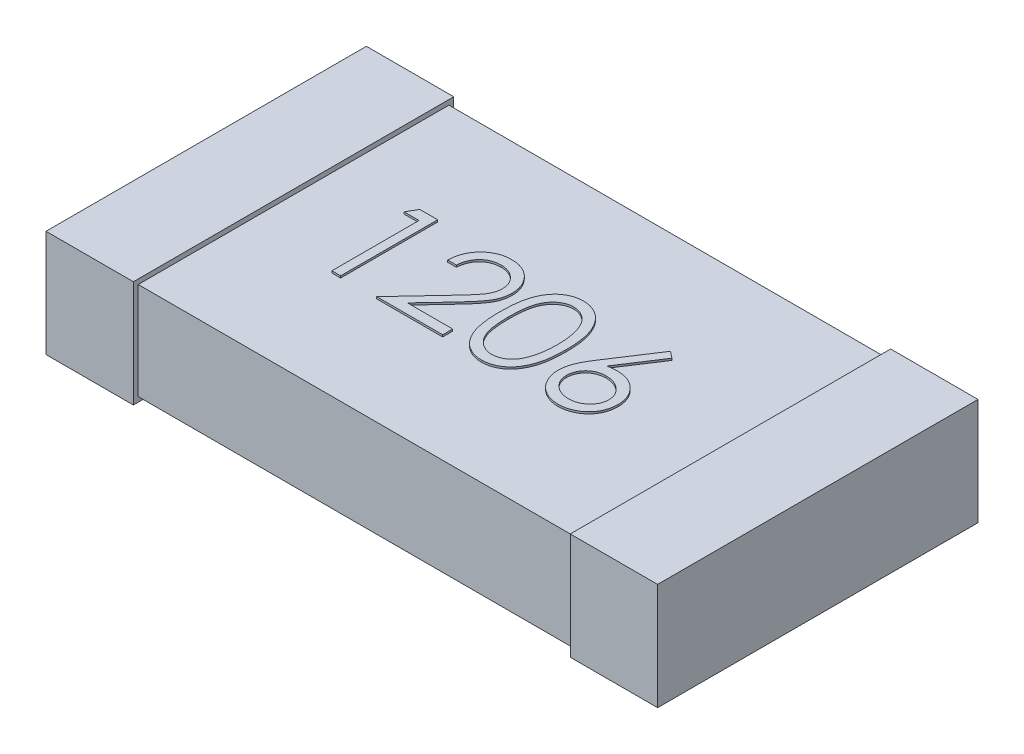
from build123d import *

# Parameters (mm, degrees)
SKETCH1_W            = 3.1
SKETCH1_H            = 1.6
BOSS_EXTRUDE1_DEPTH  = 0.5
BOSS_EXTRUDE5_DEPTH  = 1.6
SKETCH5_W            = 0.45
SKETCH5_H            = 0.55
BOSS_EXTRUDE6_DEPTH  = 0.025
SKETCH6_W            = 0.45
SKETCH6_H            = 0.55
BOSS_EXTRUDE7_DEPTH  = 0.025
BOSS_EXTRUDE8_DEPTH  = 1.6
SKETCH8_W            = 0.45
SKETCH8_H            = 0.55
BOSS_EXTRUDE9_DEPTH  = 0.025
SKETCH9_W            = 0.45
SKETCH9_H            = 0.55
BOSS_EXTRUDE10_DEPTH = 0.025
BOSS_EXTRUDE11_DEPTH = 0.01


with BuildPart() as part:
    # Sketch1 → Boss-Extrude1 (new body)
    with BuildSketch(Plane(origin=(0, 0, 0), x_dir=(1, 0, 0), z_dir=(0, 1, 0))):
        Rectangle(SKETCH1_W, SKETCH1_H)
    extrude(amount=BOSS_EXTRUDE1_DEPTH)

    # Sketch4 → Boss-Extrude5 (add)
    with BuildSketch(Plane.XY.offset(0.8)):
        Polygon((-1.125, 0.5), (-1.55, 0.5), (-1.55, 0), (-1.125, 0), (-1.125, -0.025), (-1.575, -0.025), (-1.575, 0.525), (-1.125, 0.525), align=None)
    extrude(amount=-BOSS_EXTRUDE5_DEPTH)

    # Sketch5 → Boss-Extrude6 (add)
    with BuildSketch(Plane.XY.offset(0.8)):
        with Locations((-1.35, 0.25)):
            Rectangle(SKETCH5_W, SKETCH5_H)
    extrude(amount=BOSS_EXTRUDE6_DEPTH)

    # Sketch6 → Boss-Extrude7 (add)
    with BuildSketch(Plane(origin=(0, 0, -0.8), x_dir=(-1, 0, 0), z_dir=(0, 0, -1))):
        with Locations((1.35, 0.25)):
            Rectangle(SKETCH6_W, SKETCH6_H)
    extrude(amount=BOSS_EXTRUDE7_DEPTH)

    # Sketch7 → Boss-Extrude8 (add)
    with BuildSketch(Plane.XY.offset(0.8)):
        Polygon((1.125, 0.5), (1.55, 0.5), (1.55, 0), (1.125, 0), (1.125, -0.025), (1.575, -0.025), (1.575, 0.525), (1.125, 0.525), align=None)
    extrude(amount=-BOSS_EXTRUDE8_DEPTH)

    # Sketch8 → Boss-Extrude9 (add)
    with BuildSketch(Plane.XY.offset(0.8)):
        with Locations((1.35, 0.25)):
            Rectangle(SKETCH8_W, SKETCH8_H)
    extrude(amount=BOSS_EXTRUDE9_DEPTH)

    # Sketch9 → Boss-Extrude10 (add)
    with BuildSketch(Plane(origin=(0, 0, -0.8), x_dir=(-1, 0, 0), z_dir=(0, 0, -1))):
        with Locations((-1.35, 0.25)):
            Rectangle(SKETCH9_W, SKETCH9_H)
    extrude(amount=BOSS_EXTRUDE10_DEPTH)

    # Sketch10 → Boss-Extrude11 (add)
    # profile 1 of 4: a face of its own
    with BuildSketch(Plane(origin=(0, 0.5, 0), x_dir=(1, 0, 0), z_dir=(0, 1, 0))):
        Polygon((-0.72510345, 0.25), (-0.632655533, 0.25), (-0.632655533, -0.25), (-0.677527328, -0.25), (-0.677527328, 0.198717949), (-0.754450405, 0.198717949), align=None)
    # profile 2 of 4: a face of its own
    with BuildSketch(Plane(origin=(0, 0.5, 0), x_dir=(1, 0, 0), z_dir=(0, 1, 0))):
        with BuildLine():
            Line((-0.382655533, 0.096153846), (-0.427527328, 0.096153846))
            add(Edge.make_bspline(
                [(-0.427527328, 0.096153846), (-0.427234878, 0.10210683), (-0.426660513, 0.113798332), (-0.423970757, 0.130844605), (-0.420122061, 0.147138147), (-0.414680424, 0.162548135), (-0.407922385, 0.177210822), (-0.399818095, 0.191067967), (-0.390218974, 0.204066708), (-0.379332297, 0.216086543), (-0.367508206, 0.227113339), (-0.354750215, 0.236635516), (-0.341343782, 0.244680898), (-0.327329582, 0.251406789), (-0.312549502, 0.256455339), (-0.297137665, 0.260201287), (-0.28102636, 0.262455051), (-0.270049214, 0.262697306), (-0.264466431, 0.262820513)],
                knots=[0, 0, 0, 0, 1.10065271, 2.161652631, 3.183658789, 4.190468796, 5.17591951, 6.163126047, 7.15150782, 8.156236427, 9.156009102, 10.134482811, 11.092018607, 12.041330605, 13.001268258, 13.972401359, 14.968799086, 16, 16, 16, 16], degree=3))
            add(Edge.make_bspline(
                [(-0.264466431, 0.262820513), (-0.258983849, 0.262692162), (-0.248210771, 0.262439957), (-0.232487626, 0.260274096), (-0.217519441, 0.256881868), (-0.203335475, 0.252122523), (-0.190048894, 0.245724748), (-0.177559888, 0.238039385), (-0.165719772, 0.229150838), (-0.15506166, 0.218686007), (-0.145274791, 0.207514238), (-0.136831612, 0.195587395), (-0.12960116, 0.183268925), (-0.123574349, 0.170464896), (-0.119137757, 0.15705475), (-0.115769442, 0.143233721), (-0.113865526, 0.128858748), (-0.113573322, 0.11912924), (-0.113424764, 0.114182692)],
                knots=[0, 0, 0, 0, 1.111607364, 2.184268762, 3.212621178, 4.221274766, 5.211760367, 6.196651075, 7.1921475, 8.207485113, 9.220403448, 10.201281604, 11.166441695, 12.114753415, 13.065576456, 14.026450734, 14.996634279, 16, 16, 16, 16], degree=3))
            add(Edge.make_bspline(
                [(-0.113424764, 0.114182692), (-0.113666659, 0.107218716), (-0.114146203, 0.093412971), (-0.118248257, 0.073125134), (-0.124654902, 0.053468931), (-0.13236881, 0.037649316), (-0.140150588, 0.024901674), (-0.147163089, 0.014406145), (-0.155372347, 0.003105364), (-0.164897847, -0.008962827), (-0.175542543, -0.021892957), (-0.187402852, -0.035677213), (-0.20056335, -0.05017318), (-0.209800278, -0.06007398), (-0.214586623, -0.065204327)],
                knots=[0, 0, 0, 0, 1.184426356, 2.348067706, 3.509069118, 4.696110526, 5.333549288, 6.050745305, 6.844228056, 7.710549037, 8.667450064, 9.695053472, 10.805634456, 12, 12, 12, 12], degree=3))
            Line((-0.214586623, -0.065204327), (-0.339686783, -0.198717949))
            Line((-0.339686783, -0.198717949), (-0.107014508, -0.198717949))
            Line((-0.107014508, -0.198717949), (-0.107014508, -0.25))
            Line((-0.107014508, -0.25), (-0.446758098, -0.25))
            Line((-0.446758098, -0.25), (-0.252847841, -0.04306891))
            add(Edge.make_bspline(
                [(-0.252847841, -0.04306891), (-0.248126715, -0.038140581), (-0.239058396, -0.028674268), (-0.226232314, -0.014853846), (-0.214712458, -0.002032483), (-0.20442426, 0.009765596), (-0.195590902, 0.020712963), (-0.187752011, 0.030455063), (-0.181471213, 0.039419985), (-0.174654728, 0.049811501), (-0.16805273, 0.062498975), (-0.162379536, 0.078003788), (-0.158920272, 0.093964824), (-0.158505296, 0.104750829), (-0.158296559, 0.110176282)],
                knots=[0, 0, 0, 0, 1.329631726, 2.553950428, 3.673215718, 4.687767853, 5.603093632, 6.413772471, 7.123043292, 7.734684054, 8.834405432, 9.900288307, 10.943827018, 12, 12, 12, 12], degree=3))
            add(Edge.make_bspline(
                [(-0.158296559, 0.110176282), (-0.158387379, 0.11358791), (-0.158566369, 0.120311575), (-0.16014604, 0.13016954), (-0.162533255, 0.139678799), (-0.165954006, 0.148868602), (-0.170469255, 0.157646552), (-0.175965452, 0.166023335), (-0.18230689, 0.174121759), (-0.189642785, 0.181715087), (-0.197701574, 0.188669545), (-0.206215038, 0.194830129), (-0.215222196, 0.199978573), (-0.22468507, 0.204199073), (-0.23457728, 0.207509842), (-0.244917958, 0.209803924), (-0.255678532, 0.211244279), (-0.263026174, 0.211439161), (-0.266770117, 0.211538462)],
                knots=[0, 0, 0, 0, 0.991446411, 1.95395049, 2.89581595, 3.838931463, 4.798493298, 5.75982156, 6.748411868, 7.785213223, 8.824556874, 9.840280684, 10.836137867, 11.835679398, 12.848801643, 13.863922112, 14.911575587, 16, 16, 16, 16], degree=3))
            add(Edge.make_bspline(
                [(-0.266770117, 0.211538462), (-0.270680236, 0.211436314), (-0.278359064, 0.211235713), (-0.289633211, 0.209832476), (-0.300388322, 0.207411641), (-0.310651451, 0.204100688), (-0.320439964, 0.199892324), (-0.329706256, 0.194650646), (-0.338429526, 0.188395861), (-0.346626172, 0.181304353), (-0.354178169, 0.173408981), (-0.360813437, 0.164607558), (-0.366611153, 0.155060785), (-0.371669615, 0.14479442), (-0.375777571, 0.133715309), (-0.378916592, 0.121862779), (-0.381400427, 0.109288296), (-0.382230216, 0.100604713), (-0.382655533, 0.096153846)],
                knots=[0, 0, 0, 0, 1.031018746, 2.02475058, 2.990194455, 3.934040569, 4.864654155, 5.795059489, 6.735614925, 7.690564532, 8.649604399, 9.611025574, 10.590972636, 11.591080095, 12.624614302, 13.701020113, 14.821632451, 16, 16, 16, 16], degree=3))
        make_face()
    # profile 3 of 4: a face of its own
    with BuildSketch(Plane(origin=(0, 0.5, 0), x_dir=(1, 0, 0), z_dir=(0, 1, 0))):
        with BuildLine():
            add(Edge.make_bspline(
                [(-0.062142713, -0.000200321), (-0.062095853, 0.007813592), (-0.062004828, 0.023380733), (-0.060992196, 0.046064253), (-0.059310004, 0.067344294), (-0.057004665, 0.087221875), (-0.054199239, 0.105702127), (-0.05045417, 0.122735664), (-0.046195198, 0.138401322), (-0.041259134, 0.152750186), (-0.03568945, 0.165975572), (-0.029627413, 0.17832203), (-0.022832442, 0.189770877), (-0.015692883, 0.200504847), (-0.00791973, 0.210348232), (0.000265811, 0.219440041), (0.009183222, 0.227570148), (0.018529366, 0.234976763), (0.028388861, 0.241469544), (0.03848067, 0.247188507), (0.048874257, 0.252074202), (0.059597997, 0.255915693), (0.070555506, 0.259088671), (0.081785087, 0.261258521), (0.093305281, 0.262623794), (0.101081201, 0.262754318), (0.105024755, 0.262820513)],
                knots=[0, 0, 0, 0, 1.646270934, 3.197905019, 4.663502075, 6.030701355, 7.308322542, 8.50163776, 9.611534131, 10.641858119, 11.616356847, 12.558055219, 13.465016945, 14.349605745, 15.204443733, 16.039544428, 16.859896111, 17.680448484, 18.487036065, 19.28249412, 20.06191084, 20.843045899, 21.620316918, 22.403196591, 23.190181807, 24, 24, 24, 24], degree=3))
            add(Edge.make_bspline(
                [(0.105024755, 0.262820513), (0.109001252, 0.262750825), (0.116909253, 0.262612238), (0.128600735, 0.261280246), (0.140022118, 0.259070085), (0.15112471, 0.255938518), (0.161999708, 0.252053421), (0.172562052, 0.247183833), (0.182877349, 0.241515423), (0.192781676, 0.234854869), (0.202383764, 0.22742883), (0.211447758, 0.219034163), (0.219974485, 0.209755632), (0.228070957, 0.199692508), (0.235507471, 0.188651782), (0.24258939, 0.17682548), (0.248928252, 0.164006785), (0.255033206, 0.150409576), (0.260302775, 0.135657624), (0.265055096, 0.119834087), (0.268894949, 0.10275206), (0.272093416, 0.084501168), (0.274571259, 0.065014385), (0.276375922, 0.044333483), (0.27732922, 0.022444856), (0.277508748, 0.007479449), (0.277600877, -0.000200321)],
                knots=[0, 0, 0, 0, 0.810914788, 1.612654377, 2.396697861, 3.181598691, 3.963628158, 4.749916497, 5.551656086, 6.361998678, 7.18212741, 8.025565596, 8.878627764, 9.750805457, 10.657531673, 11.591944965, 12.560506719, 13.57287815, 14.630710178, 15.753379473, 16.941251878, 18.199788006, 19.531962791, 20.947069417, 22.433333509, 24, 24, 24, 24], degree=3))
            add(Edge.make_bspline(
                [(0.277600877, -0.000200321), (0.277507793, -0.007846593), (0.277326424, -0.022745043), (0.276386609, -0.044535183), (0.274535376, -0.065106332), (0.272219663, -0.084507826), (0.269012383, -0.102658915), (0.265068787, -0.119622407), (0.26069017, -0.13547156), (0.255285199, -0.150076534), (0.249369383, -0.163641065), (0.242932927, -0.176307801), (0.236037237, -0.1881887), (0.22852456, -0.199188664), (0.220516929, -0.209385615), (0.211842959, -0.218599561), (0.202747161, -0.227052514), (0.193116816, -0.234574175), (0.183058023, -0.241157719), (0.172778155, -0.247045411), (0.162094815, -0.251792939), (0.151250107, -0.255869374), (0.140088912, -0.258983724), (0.128625142, -0.261137132), (0.116917108, -0.262647396), (0.109002599, -0.262762607), (0.105024755, -0.262820513)],
                knots=[0, 0, 0, 0, 1.561518951, 3.042555995, 4.452378317, 5.7783523, 7.031515105, 8.214008947, 9.334062868, 10.386615937, 11.391082383, 12.354592575, 13.286541444, 14.194233754, 15.072674879, 15.931287219, 16.775624067, 17.606195743, 18.42308326, 19.229000347, 20.022332153, 20.807536673, 21.593273796, 22.3848459, 23.188221202, 24, 24, 24, 24], degree=3))
            add(Edge.make_bspline(
                [(0.105024755, -0.262820513), (0.10108131, -0.262753891), (0.093305607, -0.262622525), (0.081783832, -0.26126342), (0.070600625, -0.259078348), (0.059700803, -0.256018833), (0.049028444, -0.252273857), (0.038728974, -0.247394759), (0.028687877, -0.241775606), (0.01893194, -0.23537626), (0.009644489, -0.228044591), (0.000773259, -0.219935407), (-0.007458886, -0.210846349), (-0.0151209, -0.200920931), (-0.022402913, -0.190250468), (-0.029101394, -0.178689272), (-0.035297231, -0.166283184), (-0.040960587, -0.152952054), (-0.045981824, -0.13850135), (-0.050417211, -0.122765753), (-0.053919234, -0.105606377), (-0.056916799, -0.087161039), (-0.059334568, -0.067350477), (-0.060985185, -0.046163937), (-0.062005373, -0.023614622), (-0.062096098, -0.008147511), (-0.062142713, -0.000200321)],
                knots=[0, 0, 0, 0, 0.810891512, 1.598919785, 2.382837074, 3.152667961, 3.926044502, 4.706494248, 5.493654104, 6.291793342, 7.103789334, 7.925228297, 8.761435821, 9.622817696, 10.50288917, 11.416980706, 12.369136599, 13.353924996, 14.394355917, 15.514179734, 16.714354668, 17.994756427, 19.357759367, 20.818452758, 22.365282078, 24, 24, 24, 24], degree=3))
        make_face()
        with BuildLine():
            add(Edge.make_bspline(
                [(-0.017270918, 0), (-0.017253854, -0.006678386), (-0.017220737, -0.019639821), (-0.016355565, -0.038474572), (-0.015176961, -0.056041762), (-0.013656775, -0.072363696), (-0.011399211, -0.087385126), (-0.00886967, -0.101209366), (-0.005791372, -0.113763258), (-0.002149226, -0.125132945), (0.001999216, -0.135511383), (0.006528625, -0.1451687), (0.011394443, -0.154218976), (0.016840036, -0.16258092), (0.022770759, -0.170281801), (0.029052653, -0.17745792), (0.035920165, -0.183857488), (0.0454207, -0.191532753), (0.057963054, -0.199464058), (0.073765976, -0.206370643), (0.090004326, -0.210710993), (0.101025933, -0.211262959), (0.106527159, -0.211538462)],
                knots=[0, 0, 0, 0, 1.459021318, 2.831673884, 4.118529203, 5.306027144, 6.411944654, 7.436330062, 8.375795394, 9.233974572, 10.042671642, 10.816086306, 11.563610507, 12.285937304, 12.993564865, 13.685989202, 14.367179055, 15.041617293, 16.353048772, 17.594441528, 18.799311195, 20, 20, 20, 20], degree=3))
            add(Edge.make_bspline(
                [(0.106527159, -0.211538462), (0.112063969, -0.211310207), (0.123126158, -0.21085417), (0.139288129, -0.20645435), (0.154978167, -0.199815844), (0.167274159, -0.191966201), (0.176628808, -0.184490725), (0.183331235, -0.178117204), (0.189482956, -0.170980651), (0.195317538, -0.163280752), (0.200668835, -0.154870397), (0.205534997, -0.145790029), (0.209975476, -0.136014432), (0.212505339, -0.129190184), (0.213798793, -0.125701122)],
                knots=[0, 0, 0, 0, 1.353760809, 2.704726607, 4.075137775, 5.516104923, 6.260822281, 7.007110065, 7.778089737, 8.566572457, 9.372053459, 10.217411131, 11.088608312, 12, 12, 12, 12], degree=3))
            add(Edge.make_bspline(
                [(0.213798793, -0.125701122), (0.215306189, -0.12123973), (0.218366848, -0.112181193), (0.222311387, -0.098129242), (0.225417873, -0.08338599), (0.228212639, -0.068039545), (0.230120219, -0.051976731), (0.231655621, -0.035247247), (0.232560004, -0.017838481), (0.232672112, -0.006010625), (0.232729082, 0)],
                knots=[0, 0, 0, 0, 0.884706709, 1.796334032, 2.740027952, 3.714592787, 4.726048262, 5.777819803, 6.87074269, 8, 8, 8, 8], degree=3))
            add(Edge.make_bspline(
                [(0.232729082, 0), (0.232650483, 0.006009653), (0.232496728, 0.01776582), (0.231909016, 0.034982703), (0.230391362, 0.05133524), (0.228705774, 0.066893879), (0.226220456, 0.081572493), (0.22354077, 0.095493966), (0.219940596, 0.108485826), (0.216094914, 0.120751481), (0.211693429, 0.132151574), (0.206848324, 0.142739258), (0.201673787, 0.152565647), (0.196053467, 0.161603782), (0.190054084, 0.169894145), (0.183517291, 0.177270516), (0.176702381, 0.183961511), (0.167157069, 0.191599021), (0.154660741, 0.199386406), (0.139111363, 0.206552943), (0.122929843, 0.210668414), (0.111990778, 0.211248655), (0.106527159, 0.211538462)],
                knots=[0, 0, 0, 0, 1.31362396, 2.569729283, 3.763502607, 4.902122613, 5.988968491, 7.01645872, 7.998833611, 8.933434873, 9.825090667, 10.667526885, 11.477055099, 12.250526234, 12.991942729, 13.710640831, 14.402115721, 15.076753259, 16.378508321, 17.609869233, 18.806226677, 20, 20, 20, 20], degree=3))
            add(Edge.make_bspline(
                [(0.106527159, 0.211538462), (0.100997074, 0.211248255), (0.089926831, 0.210667313), (0.073577123, 0.206568277), (0.057905073, 0.199423567), (0.04544179, 0.191573228), (0.035889821, 0.184096327), (0.029163722, 0.177612548), (0.022857126, 0.170520225), (0.017047454, 0.162748523), (0.011606128, 0.154396328), (0.006608841, 0.145397933), (0.002106365, 0.135707738), (-0.002048569, 0.125333962), (-0.005701824, 0.113965255), (-0.008715247, 0.101426828), (-0.011499112, 0.087646557), (-0.013469865, 0.072543771), (-0.01522183, 0.056217749), (-0.016347737, 0.038606703), (-0.017223631, 0.019740363), (-0.01725484, 0.006711912), (-0.017270918, 0)],
                knots=[0, 0, 0, 0, 1.207732386, 2.417664972, 3.655092373, 4.956220595, 5.625982001, 6.301752483, 6.994047911, 7.697131622, 8.419323945, 9.170223765, 9.943494443, 10.752040957, 11.610060368, 12.549350801, 13.567764191, 14.679664412, 15.874934091, 17.154273443, 18.533957287, 20, 20, 20, 20], degree=3))
        make_face(mode=Mode.SUBTRACT)
    # profile 4 of 4: a face of its own
    with BuildSketch(Plane(origin=(0, 0.5, 0), x_dir=(1, 0, 0), z_dir=(0, 1, 0))):
        with BuildLine():
            Line((0.553241902, 0.262820513), (0.587797191, 0.235677083))
            Line((0.587797191, 0.235677083), (0.455685813, 0.033653846))
            add(Edge.make_bspline(
                [(0.455685813, 0.033653846), (0.464481567, 0.035055826), (0.481638679, 0.037790547), (0.499005236, 0.038241682), (0.507468665, 0.038461538)],
                knots=[0, 0, 0, 0, 1.025318673, 2, 2, 2, 2], degree=3))
            add(Edge.make_bspline(
                [(0.507468665, 0.038461538), (0.51255045, 0.038324951), (0.522553793, 0.038056083), (0.537240479, 0.035986961), (0.551353184, 0.032726231), (0.564833415, 0.027973052), (0.577729555, 0.021901287), (0.590115612, 0.014624305), (0.601758756, 0.005766351), (0.612808924, -0.004128643), (0.622841367, -0.015088212), (0.631723661, -0.026716974), (0.639184631, -0.039002814), (0.645238048, -0.05193951), (0.649938745, -0.065507118), (0.653365552, -0.079688281), (0.655391208, -0.094492777), (0.655666278, -0.104561088), (0.655806005, -0.109675481)],
                knots=[0, 0, 0, 0, 1.04369286, 2.054478336, 3.041073146, 4.015093852, 4.984733326, 5.965804835, 6.960378782, 7.985147595, 9.009457201, 10.008161701, 10.986880575, 11.956520048, 12.937015923, 13.931873656, 14.949455224, 16, 16, 16, 16], degree=3))
            add(Edge.make_bspline(
                [(0.655806005, -0.109675481), (0.655602704, -0.116672581), (0.655202657, -0.130441219), (0.6512164, -0.150495035), (0.645022165, -0.16959968), (0.636168232, -0.187450133), (0.625170749, -0.204021928), (0.611759664, -0.218705566), (0.596410595, -0.231801286), (0.579055338, -0.242752231), (0.560377772, -0.251695524), (0.540756058, -0.25811913), (0.520380751, -0.262073912), (0.506551521, -0.262569712), (0.499556005, -0.262820513)],
                knots=[0, 0, 0, 0, 1.031375318, 2.029502543, 3.004789286, 3.987476834, 4.960371455, 5.9300674, 6.912260825, 7.929083631, 8.949397511, 9.960523116, 10.96833055, 12, 12, 12, 12], degree=3))
            add(Edge.make_bspline(
                [(0.499556005, -0.262820513), (0.492827905, -0.262602198), (0.479500717, -0.262169754), (0.459896032, -0.258317477), (0.441058458, -0.252073605), (0.423119975, -0.243471565), (0.406502744, -0.232606153), (0.391636225, -0.219525828), (0.378594543, -0.20451019), (0.367741026, -0.187561569), (0.359132635, -0.169348718), (0.352676932, -0.150357695), (0.34890604, -0.130657698), (0.348379103, -0.11730325), (0.348113697, -0.110576923)],
                knots=[0, 0, 0, 0, 1.012016664, 2.004627821, 2.994792927, 3.992885782, 4.990978636, 5.973936114, 6.964471063, 7.975201453, 8.993600317, 9.990122807, 10.98767138, 12, 12, 12, 12], degree=3))
            add(Edge.make_bspline(
                [(0.348113697, -0.110576923), (0.348282475, -0.105427697), (0.348627087, -0.094913961), (0.351033286, -0.078990528), (0.354899685, -0.062697517), (0.35922972, -0.048875489), (0.363804807, -0.037552414), (0.367612313, -0.028423344), (0.372351455, -0.019028905), (0.377404796, -0.009046957), (0.383227205, 0.001265247), (0.389558013, 0.012080057), (0.396572248, 0.023225476), (0.401489414, 0.030788932), (0.40400312, 0.034655449)],
                knots=[0, 0, 0, 0, 1.173818275, 2.396712641, 3.66331629, 4.989737886, 5.693666774, 6.447286557, 7.243889047, 8.091586357, 8.998013824, 9.943181721, 10.948533338, 12, 12, 12, 12], degree=3))
            Line((0.40400312, 0.034655449), (0.553241902, 0.262820513))
        make_face()
        with BuildLine():
            add(Edge.make_bspline(
                [(0.498053601, -0.012820513), (0.494244709, -0.012931662), (0.486804836, -0.013148768), (0.475889491, -0.014409519), (0.465559027, -0.016783671), (0.455676579, -0.019807433), (0.446426907, -0.023965013), (0.437742787, -0.02901527), (0.429590637, -0.034961152), (0.422055844, -0.041718425), (0.415224463, -0.049116716), (0.409341445, -0.057040933), (0.404266816, -0.065300105), (0.400140842, -0.07396324), (0.396927974, -0.083027025), (0.394603938, -0.092449775), (0.393310545, -0.102294676), (0.393095369, -0.108970748), (0.392985492, -0.112379808)],
                knots=[0, 0, 0, 0, 1.129588631, 2.206414736, 3.251139165, 4.268635594, 5.265702196, 6.250456724, 7.242448911, 8.251968645, 9.246821453, 10.222880186, 11.173611482, 12.116736599, 13.062300278, 14.020270554, 14.989073742, 16, 16, 16, 16], degree=3))
            add(Edge.make_bspline(
                [(0.392985492, -0.112379808), (0.393074972, -0.115758376), (0.39325043, -0.122383246), (0.394843618, -0.132145986), (0.397277201, -0.141540973), (0.400897258, -0.150519773), (0.405215385, -0.159219247), (0.410916146, -0.167324288), (0.417232829, -0.175327155), (0.424783391, -0.182613079), (0.432886729, -0.189392597), (0.441544043, -0.195318348), (0.450566895, -0.200387801), (0.460077098, -0.204360815), (0.469939724, -0.207621427), (0.480236946, -0.209915924), (0.490975926, -0.211213142), (0.498250488, -0.211428599), (0.501959851, -0.211538462)],
                knots=[0, 0, 0, 0, 0.989467248, 1.94019797, 2.891935182, 3.827694429, 4.772920941, 5.730924762, 6.725747692, 7.756678648, 8.79901574, 9.819492441, 10.826891316, 11.826466727, 12.835195252, 13.867842842, 14.912794438, 16, 16, 16, 16], degree=3))
            add(Edge.make_bspline(
                [(0.501959851, -0.211538462), (0.505669208, -0.21142859), (0.512943759, -0.211213117), (0.523682824, -0.209916021), (0.533979727, -0.207621072), (0.543843514, -0.204362104), (0.553349433, -0.200383017), (0.562364393, -0.195349886), (0.570939835, -0.189356155), (0.579048492, -0.182624665), (0.586567626, -0.175285686), (0.593035809, -0.167395726), (0.598561985, -0.159153741), (0.603052583, -0.150554042), (0.606632768, -0.141535544), (0.609078691, -0.132147441), (0.61066859, -0.122382865), (0.610844499, -0.115758248), (0.61093421, -0.112379808)],
                knots=[0, 0, 0, 0, 1.087397944, 2.132534446, 3.165364764, 4.174271784, 5.174024072, 6.181601208, 7.194203697, 8.236725232, 9.267838612, 10.269026844, 11.221737037, 12.171628256, 13.107553087, 14.05945871, 15.010357665, 16, 16, 16, 16], degree=3))
            add(Edge.make_bspline(
                [(0.61093421, -0.112379808), (0.610855597, -0.1089663), (0.610701304, -0.102266696), (0.608956169, -0.092454179), (0.60653583, -0.082979149), (0.602881111, -0.073901157), (0.598133033, -0.065256024), (0.59234969, -0.057000081), (0.585659322, -0.049070032), (0.577931102, -0.041703916), (0.569518212, -0.034968619), (0.560573128, -0.029022968), (0.551214846, -0.024005115), (0.541452854, -0.019818386), (0.5311753, -0.016797032), (0.520548108, -0.014417998), (0.50943536, -0.013151995), (0.501895844, -0.012932414), (0.498053601, -0.012820513)],
                knots=[0, 0, 0, 0, 0.978206639, 1.919901502, 2.851605144, 3.780102724, 4.718870031, 5.675451981, 6.667674623, 7.690630536, 8.733308323, 9.756129687, 10.767539656, 11.776269907, 12.797430371, 13.836405707, 14.897401972, 16, 16, 16, 16], degree=3))
        make_face(mode=Mode.SUBTRACT)
    extrude(amount=BOSS_EXTRUDE11_DEPTH)


solid = part.part
